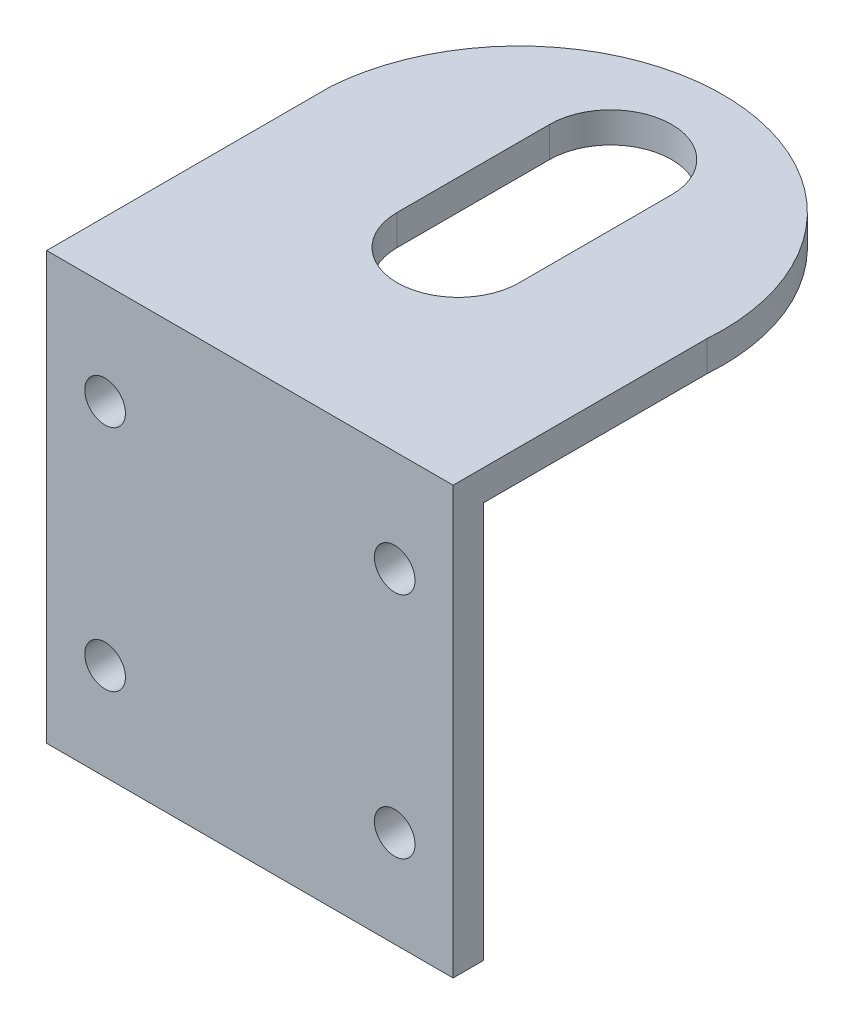
from build123d import *

# Parameters (mm, degrees)
EXTRUDE2_DEPTH = 3
SKETCH3_W      = 40
SKETCH3_H      = 3
EXTRUDE3_DEPTH = 39
SKETCH4_R      = 2
EXTRUDE4_DEPTH = 73.752827534


with BuildPart() as part:
    # Sketch1 → Extrude2 (new body)
    with BuildSketch(Plane(origin=(0, 0, 0), x_dir=(1, 0, 0), z_dir=(0, 1, 0))):
        with BuildLine():
            Line((0, 0), (40, 0))
            Line((40, 0), (40, 25))
            ThreePointArc((40, 25), (21.5, 46.5), (0, 28))
            Line((0, 28), (0, 0))
        make_face()
        with BuildLine():
            Line((26, 35.5), (26, 20.5))
            ThreePointArc((26, 20.5), (20, 14.5), (14, 20.5))
            Line((14, 20.5), (14, 35.5))
            ThreePointArc((14, 35.5), (20, 41.5), (26, 35.5))
        make_face(mode=Mode.SUBTRACT)
    extrude(amount=EXTRUDE2_DEPTH)

    # Sketch3 → Extrude3 (add)
    with BuildSketch(Plane.XZ):
        with Locations((20, -1.5)):
            Rectangle(SKETCH3_W, SKETCH3_H)
    extrude(amount=EXTRUDE3_DEPTH)

    # Sketch4 → Extrude4 (cut, through all)
    with BuildSketch(Plane.XY):
        with Locations((34.25, -7)):
            Circle(SKETCH4_R)
        with Locations((5.75, -7)):
            Circle(SKETCH4_R)
        with Locations((5.75, -29.5)):
            Circle(SKETCH4_R)
        with Locations((34.25, -29.5)):
            Circle(SKETCH4_R)
    extrude(amount=-EXTRUDE4_DEPTH, mode=Mode.SUBTRACT)


solid = part.part
